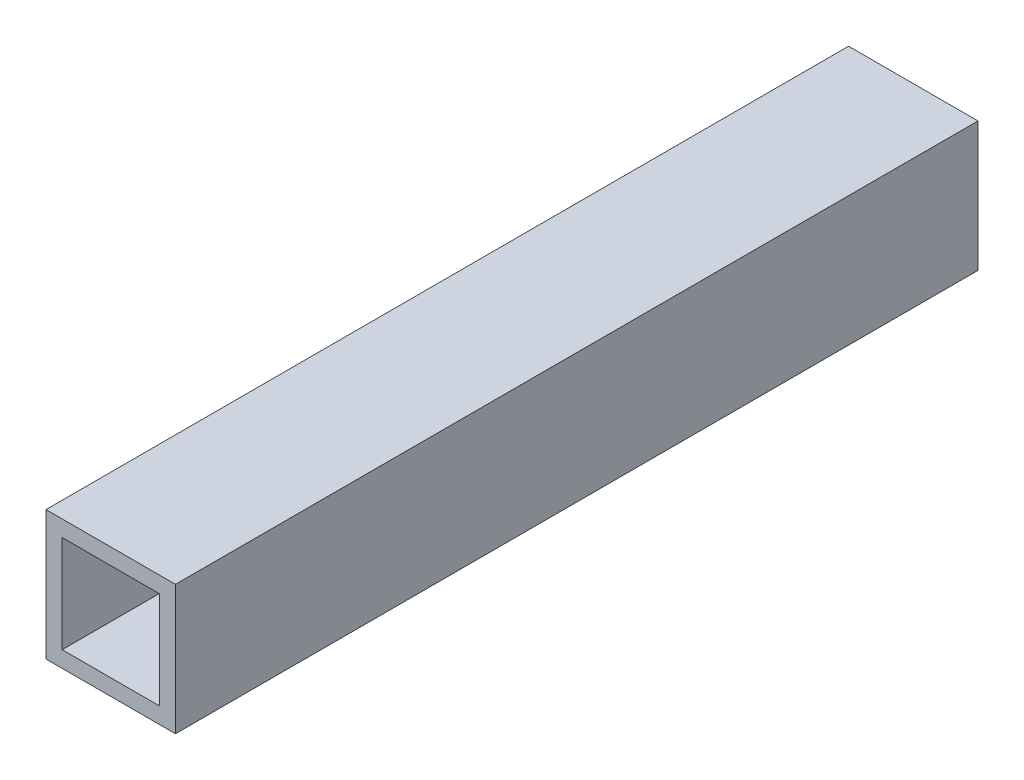
from build123d import *

# Parameters (mm, degrees)
BOSS_EXTRUDE1_DEPTH      = 78.74
BOSS_EXTRUDE1_DEPTH_BACK = 78.74
SKETCH3_W                = 25.4
SKETCH3_H                = 25.4
SKETCH3_W_2              = 19.05
SKETCH3_H_2              = 19.05


with BuildPart() as part:
    # Sketch3 → Boss-Extrude1 (new, two sides: drawn at the far end of the back side and taken through both)
    with BuildSketch(Plane.XY.offset(-BOSS_EXTRUDE1_DEPTH_BACK)):
        Rectangle(SKETCH3_W, SKETCH3_H)
        Rectangle(SKETCH3_W_2, SKETCH3_H_2, mode=Mode.SUBTRACT)
    extrude(amount=BOSS_EXTRUDE1_DEPTH + BOSS_EXTRUDE1_DEPTH_BACK)


solid = part.part
